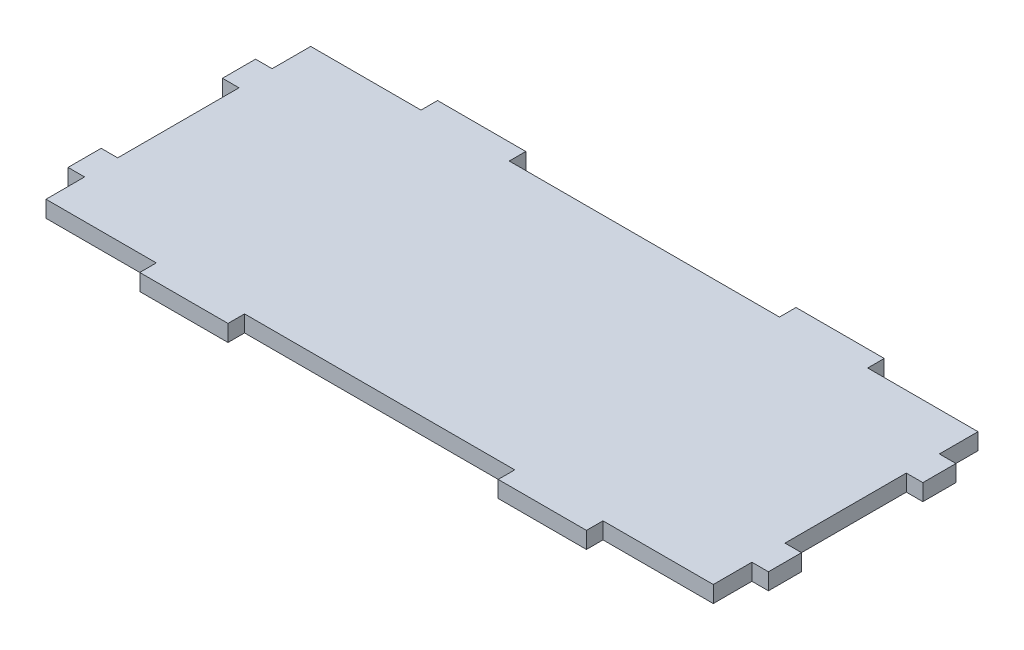
from build123d import *

# Parameters (mm, degrees)
SKETCH1_W           = 3
SKETCH1_H           = 6
SKETCH1_W_2         = 16
SKETCH1_H_2         = 3
BOSS_EXTRUDE1_DEPTH = 3


with BuildPart() as part:
    # Sketch1 → Boss-Extrude1 (new body)
    with BuildSketch(Plane(origin=(0, 0, 0), x_dir=(1, 0, 0), z_dir=(0, 1, 0))):
        Polygon((60.5, 0), (60.5, 48), (36, 48), (20, 48), (0, 48), (0, 41), (0, 35), (0, 13), (0, 7), (0, 0), (20, 0), (36, 0), align=None)
        Polygon((85, 48), (60.5, 48), (60.5, 0), (85, 0), (101, 0), (121, 0), (121, 7), (121, 13), (121, 35), (121, 41), (121, 48), (101, 48), align=None)
        with Locations((-1.5, 10)):
            Rectangle(SKETCH1_W, SKETCH1_H)
        with Locations((28, -1.5)):
            Rectangle(SKETCH1_W_2, SKETCH1_H_2)
        with Locations((93, -1.5)):
            Rectangle(SKETCH1_W_2, SKETCH1_H_2)
        with Locations((122.5, 38)):
            Rectangle(SKETCH1_W, SKETCH1_H)
        with Locations((122.5, 10)):
            Rectangle(SKETCH1_W, SKETCH1_H)
        with Locations((-1.5, 38)):
            Rectangle(SKETCH1_W, SKETCH1_H)
        with Locations((28, 49.5)):
            Rectangle(SKETCH1_W_2, SKETCH1_H_2)
        with Locations((93, 49.5)):
            Rectangle(SKETCH1_W_2, SKETCH1_H_2)
    extrude(amount=BOSS_EXTRUDE1_DEPTH)


solid = part.part
